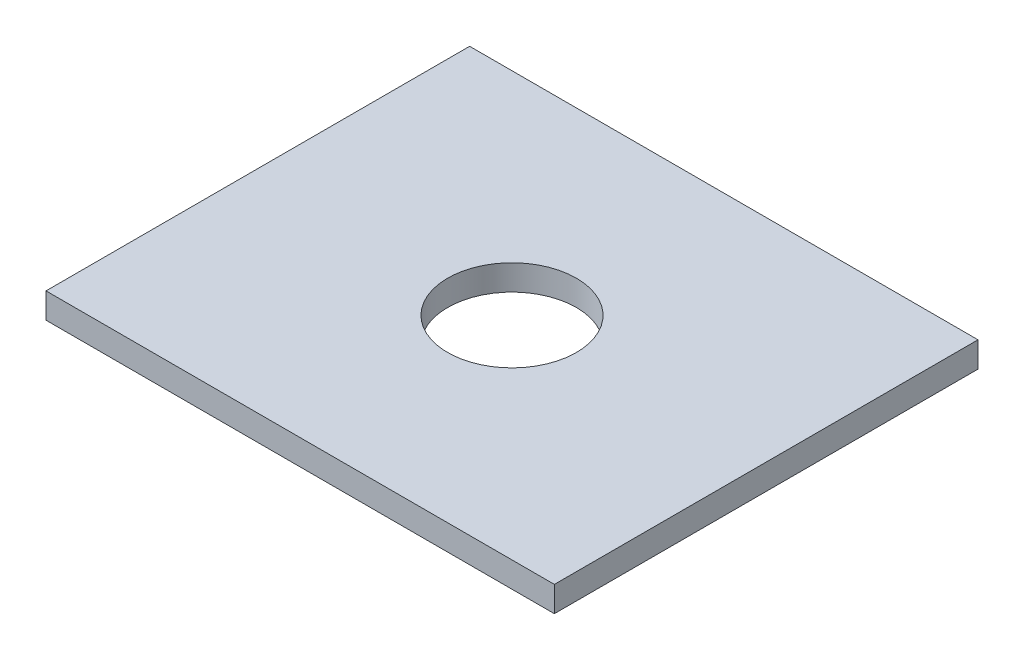
from build123d import *

# Parameters (mm, degrees)
SKETCH1_W           = 300
SKETCH1_H           = 250
BOSS_EXTRUDE1_DEPTH = 15
SKETCH3_R           = 38
CUT_EXTRUDE1_DEPTH  = 15


with BuildPart() as part:
    # Sketch1 → Boss-Extrude1 (new body)
    with BuildSketch(Plane(origin=(0, 0, 0), x_dir=(1, 0, 0), z_dir=(0, 1, 0))):
        Rectangle(SKETCH1_W, SKETCH1_H)
    extrude(amount=-BOSS_EXTRUDE1_DEPTH)

    # Sketch3 → Cut-Extrude1 (cut)
    with BuildSketch(Plane(origin=(0, -15, 0), x_dir=(-1, 0, 0), z_dir=(0, -1, 0))):
        with Locations(Location((0, 0, 0), (0, 0, 90))):
            Circle(SKETCH3_R)
    extrude(amount=-CUT_EXTRUDE1_DEPTH, mode=Mode.SUBTRACT)


solid = part.part
